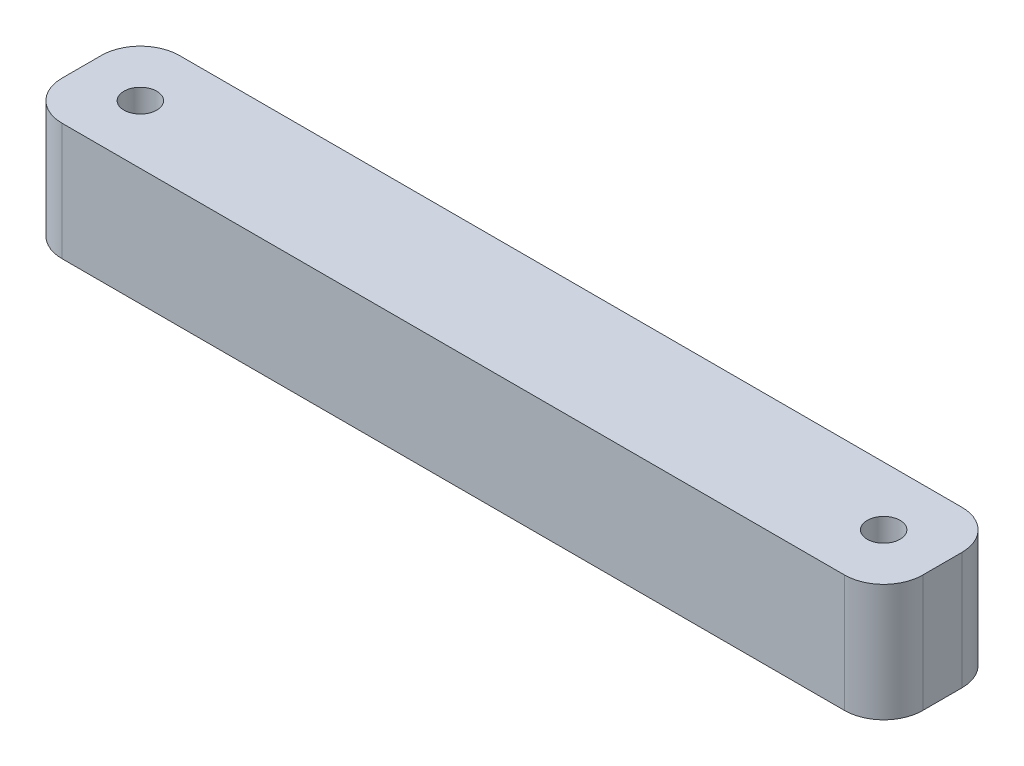
from build123d import *

# Parameters (mm, degrees)
SKETCH_1_W      = 110
SKETCH_1_H      = 15
SKETCH_1_R      = 2.1
EXTRUDE_1_DEPTH = 15
FILLET_1_R      = 5


with BuildPart() as part:
    # 草图1 → 凸台-拉伸1 (new body)
    with BuildSketch(Plane(origin=(0, 0, 0), x_dir=(1, 0, 0), z_dir=(0, 1, 0))):
        with Locations((55, 7.5)):
            Rectangle(SKETCH_1_W, SKETCH_1_H)
        with Locations(Location((7.5, 7.5, 0), (0, 0, 270))):
            Circle(SKETCH_1_R, mode=Mode.SUBTRACT)
        with Locations(Location((102.5, 7.5, 0), (0, 0, 270))):
            Circle(SKETCH_1_R, mode=Mode.SUBTRACT)
    extrude(amount=EXTRUDE_1_DEPTH)

    # 圆角1
    fillet_1_edges = [part.edges().sort_by_distance(p)[0] for p in [
        (0, 7.5, -15),
        (110, 7.5, -15),
        (110, 7.5, 0),
        (0, 7.5, 0),
    ]]
    fillet(fillet_1_edges, radius=FILLET_1_R)


solid = part.part
